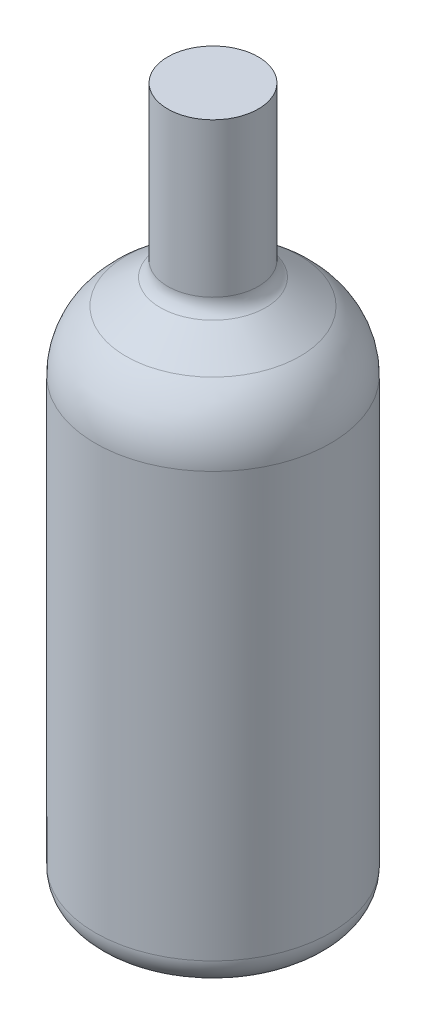
from build123d import *

# Parameters (mm, degrees)
ESQUISSE1_R        = 41.275
BOSS_EXTRU_1_DEPTH = 158.75
CONG_1_R           = 10


with BuildPart() as part:
    # Esquisse1 → Boss.-Extru.1 (new body)
    with BuildSketch(Plane(origin=(0, 0, 0), x_dir=(1, 0, 0), z_dir=(0, 1, 0))):
        with Locations(Location((0, 0, 0), (0, 0, 90))):
            Circle(ESQUISSE1_R)
    extrude(amount=BOSS_EXTRU_1_DEPTH)

    # Esquisse2 → Révolution1 (revolve)
    with BuildSketch(Plane.XY, mode=Mode.PRIVATE) as r_volution1_sk:
        with BuildLine():
            Line((18.489381751, 188.598064752), (30.542749869, 179.829366122))
            ThreePointArc((30.542749869, 179.829366122), (38.437502567, 170.577096738), (41.275, 158.75))
            Line((41.275, 158.75), (0, 158.75))
            Line((0, 158.75), (0, 247.65))
            Line((0, 247.65), (15.875, 247.65))
            Line((15.875, 247.65), (15.875, 193.733009377))
            ThreePointArc((15.875, 193.733009377), (16.56621586, 190.851922419), (18.489381751, 188.598064752))
        make_face()
    revolve(r_volution1_sk.sketch.rotate(Axis((0, 247.65, 0), (0, -1, 0)), 180), axis=Axis((0, 247.65, 0), (0, -1, 0)))

    # Congé1
    cong_1_edges = [part.edges().sort_by_distance(p)[0] for p in [
        (0, 0, 41.275),
    ]]
    fillet(cong_1_edges, radius=CONG_1_R)


solid = part.part
